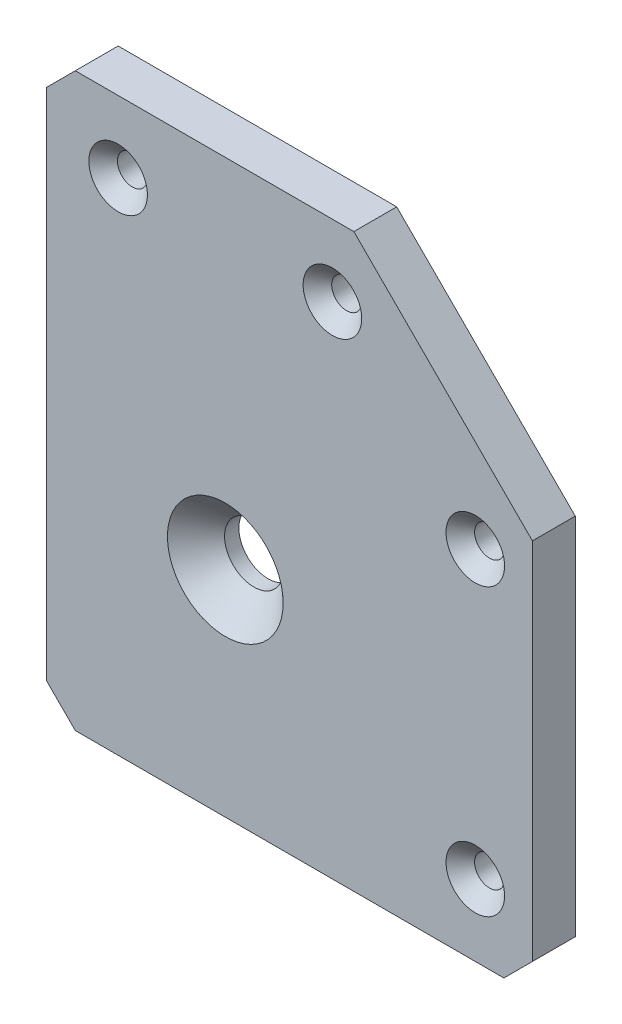
from build123d import *

# Parameters (mm, degrees)
SKETCH_1_W      = 68
SKETCH_1_H      = 80
SKETCH_1_R      = 4.1
SKETCH_1_R_2    = 2.1
EXTRUDE_1_DEPTH = 3
CHAMFER_1_SIZE  = 25
CHAMFER_2_SIZE  = 4
CHAMFER_3_SIZE  = 2


with BuildPart() as part:
    # 草图1 → 凸台-拉伸1 (new, symmetric)
    with BuildSketch(Plane.XY):
        with Locations((9, 10)):
            Rectangle(SKETCH_1_W, SKETCH_1_H)
        Circle(SKETCH_1_R, mode=Mode.SUBTRACT)
        with Locations((35, 20)):
            Circle(SKETCH_1_R_2, mode=Mode.SUBTRACT)
        with Locations((35, -20)):
            Circle(SKETCH_1_R_2, mode=Mode.SUBTRACT)
        with Locations((-15, 40)):
            Circle(SKETCH_1_R_2, mode=Mode.SUBTRACT)
        with Locations((15, 40)):
            Circle(SKETCH_1_R_2, mode=Mode.SUBTRACT)
    extrude(amount=EXTRUDE_1_DEPTH, both=True)

    # 倒角1
    chamfer_1_edges = [part.edges().sort_by_distance(p)[0] for p in [
        (43, 50, 0),
    ]]
    chamfer(chamfer_1_edges, length=CHAMFER_1_SIZE)

    # 倒角2
    chamfer_2_edges = [part.edges().sort_by_distance(p)[0] for p in [
        (-4.1, 0, 3),
        (-25, 50, 0),
        (43, -30, 0),
        (-25, -30, 0),
    ]]
    chamfer(chamfer_2_edges, length=CHAMFER_2_SIZE)

    # 倒角3
    chamfer_3_edges = [part.edges().sort_by_distance(p)[0] for p in [
        (32.9, 20, 3),
        (32.9, -20, 3),
        (-17.1, 40, 3),
        (12.9, 40, 3),
    ]]
    chamfer(chamfer_3_edges, length=CHAMFER_3_SIZE)


solid = part.part
